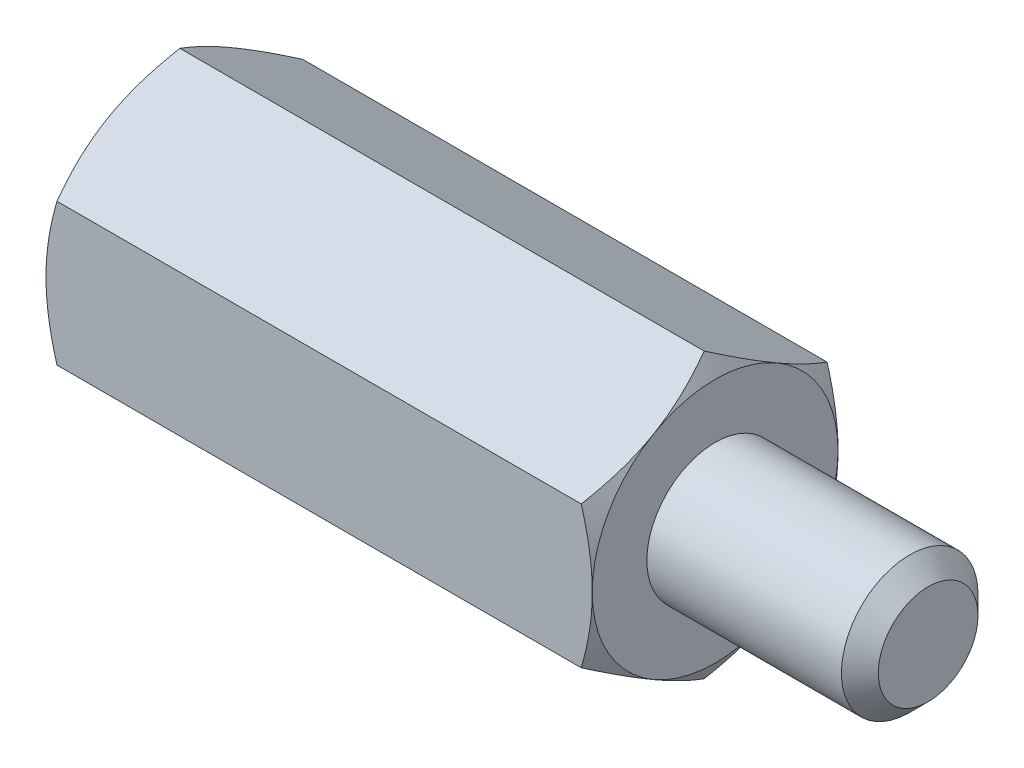
from build123d import *

# Parameters (mm, degrees)
SKETCH2_R         = 1.25
EXTRUDE1_DEPTH    = 3.9
CHAMFER1_SIZE     = 0.3375
EXTRUDE4_DEPTH    = 10
SKETCH8_OUTSIDE_W = 62.666
SKETCH8_OUTSIDE_H = 63.362
SKETCH8_OUTSIDE_R = 2.25
EXTRUDE5_DEPTH    = 15.318606776
EXTRUDE5_DRAFT    = -60
SKETCH9_OUTSIDE_W = 49.696
SKETCH9_OUTSIDE_H = 50.392
SKETCH9_OUTSIDE_R = 2.25
EXTRUDE6_DEPTH    = 11.574142991
EXTRUDE6_DRAFT    = -60
EXTRUDE7_START    = -4.8
SKETCH10_R        = 1.25
EXTRUDE7_DEPTH    = 4.8
SKETCH13_R        = 1.3008
EXTRUDE8_DEPTH    = 15.318606776


with BuildPart() as part:
    # Sketch2 → Extrude1 (new body)
    with BuildSketch(Plane(origin=(6.95, 0, 0), x_dir=(0, 0, -1), z_dir=(1, 0, 0))):
        Circle(SKETCH2_R)
    extrude(amount=-EXTRUDE1_DEPTH)

    # Chamfer1
    chamfer1_edges = [part.edges().sort_by_distance(p)[0] for p in [
        (6.95, 0, 1.25),
    ]]
    chamfer(chamfer1_edges, length=CHAMFER1_SIZE)

    # Sketch7 → Extrude4 (add)
    with BuildSketch(Plane(origin=(3.05, 0, 0), x_dir=(0, 0, -1), z_dir=(1, 0, 0))):
        Polygon((0, 2.598076211), (-2.25, 1.299038106), (-2.25, -1.299038106), (0, -2.598076211), (2.25, -1.299038106), (2.25, 1.299038106), align=None)
    extrude(amount=-EXTRUDE4_DEPTH)


with BuildPart() as extrude5_tool:
    # Sketch8 outside → Extrude5 (with draft: the straight prism first)
    with BuildSketch(Plane.ZY.offset(6.95)):
        Rectangle(SKETCH8_OUTSIDE_W, SKETCH8_OUTSIDE_H)
        Circle(SKETCH8_OUTSIDE_R, mode=Mode.SUBTRACT)
    extrude(amount=-EXTRUDE5_DEPTH)
    # Extrude5: the draft: its side faces are tilted about the plane it starts from
    extrude5_sides = [extrude5_tool.faces().sort_by_distance(p)[0] for p in [
        (0.709303388, -31.681, 0),
        (0.709303388, 0, 31.333),
        (0.709303388, 31.681, 0),
        (0.709303388, 0, -31.333),
        (0.709303388, 0, -2.25),
    ]]
    draft(extrude5_sides, Plane.ZY.offset(6.95), EXTRUDE5_DRAFT)


with BuildPart() as part_1:
    add(part.part)

    # Extrude5: cut by extrude5_tool
    add(extrude5_tool.part, mode=Mode.SUBTRACT)


with BuildPart() as extrude6_tool:
    # Sketch9 outside → Extrude6 (with draft: the straight prism first)
    with BuildSketch(Plane(origin=(3.05, 0, 0), x_dir=(0, 0, -1), z_dir=(1, 0, 0))):
        Rectangle(SKETCH9_OUTSIDE_W, SKETCH9_OUTSIDE_H)
        Circle(SKETCH9_OUTSIDE_R, mode=Mode.SUBTRACT)
    extrude(amount=-EXTRUDE6_DEPTH)
    # Extrude6: the draft: its side faces are tilted about the plane it starts from
    extrude6_sides = [extrude6_tool.faces().sort_by_distance(p)[0] for p in [
        (-2.737071496, -25.196, 0),
        (-2.737071496, 0, -24.848),
        (-2.737071496, 25.196, 0),
        (-2.737071496, 0, 24.848),
        (-2.737071496, 0, 2.25),
    ]]
    draft(extrude6_sides, Plane(origin=(3.05, 0, 0), x_dir=(0, 0, -1), z_dir=(1, 0, 0)), EXTRUDE6_DRAFT)


with BuildPart() as part_2:
    add(part_1.part)

    # Extrude6: cut by extrude6_tool
    add(extrude6_tool.part, mode=Mode.SUBTRACT)

    # Sketch10 → Extrude7 (cut)
    with BuildSketch(Plane.ZY.offset(6.95).offset(EXTRUDE7_START)):
        with Locations(Location((0, 0, 0), (0, 0, 180))):
            Circle(SKETCH10_R)
    extrude(amount=EXTRUDE7_DEPTH, mode=Mode.SUBTRACT)

    # Sketch13 → Extrude8 (cut)
    with BuildSketch(Plane.ZY.offset(6.95)):
        Circle(SKETCH13_R)
    extrude(amount=EXTRUDE8_DEPTH, mode=Mode.SUBTRACT)

    # Extrude8 cone 1 section (through the dimple's axis) → Extrude8 other way (revolve, cut)
    with BuildSketch(Plane(origin=(-6.95, 0, 0), x_dir=(0, 0, 1), z_dir=(0, 1, 0))):
        Polygon((0, 0), (1.3008, 0), (0, 1.3008), align=None)
    revolve(axis=Axis((-6.95, 0, 0), (1, 0, 0)), mode=Mode.SUBTRACT)


solid = part_2.part
